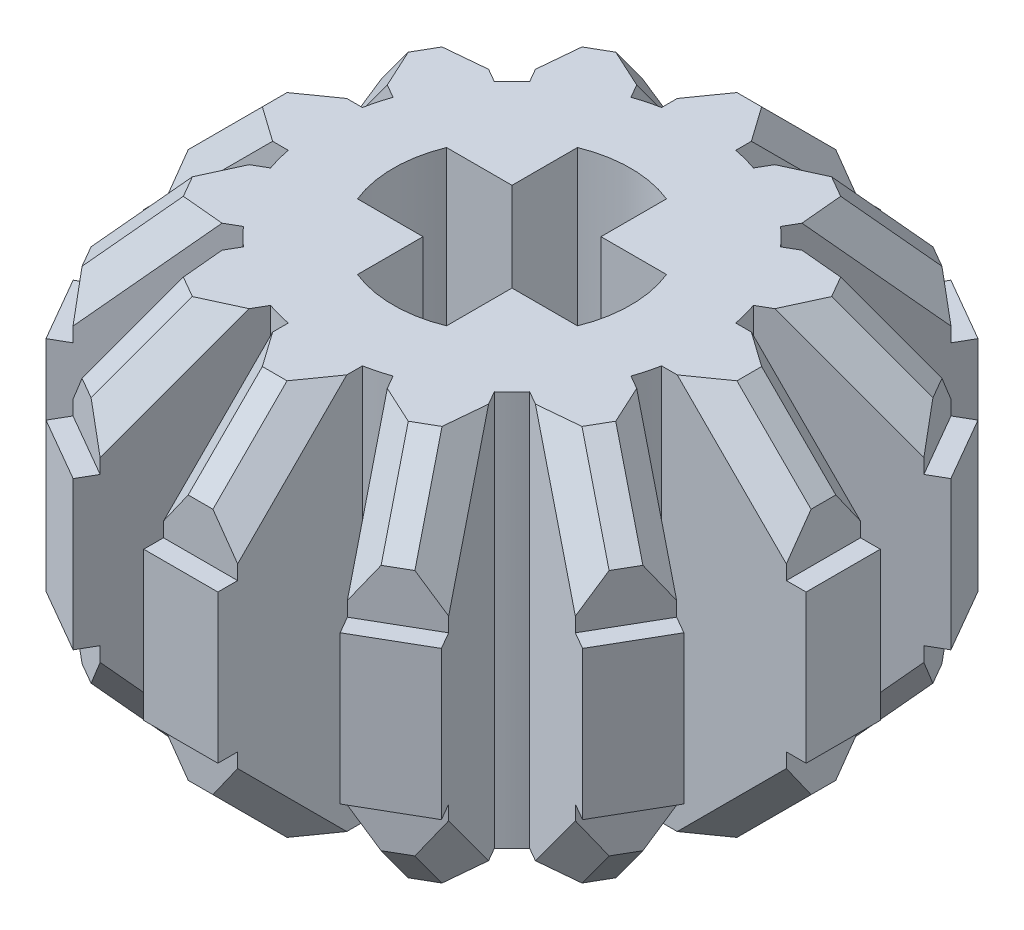
from build123d import *

# Parameters (mm, degrees)
SKETCH1_R                    = 3.85
GEAR_BODY_DEPTH              = 4
TOOTH_MIDDLE_DEPTH           = 1.5
TOOTH_OUTER_DEPTH            = 4
CHAMFER1_SIZE                = 1.5
CHAMFER2_SIZE                = 0.5
CIRPATTERN1_COUNT            = 12
CHAMFER1_OF_CIRPATTERN1_SIZE = 1.5
CHAMFER2_OF_CIRPATTERN1_SIZE = 0.5
AXLE_CUT_DEPTH               = 11.284940447
AXLE_CUT_DEPTH_BACK          = 11.284940447
SKETCH4_W                    = 1.8
SKETCH4_H                    = 1.8


with BuildPart() as part:
    # Sketch1 → Gear Body (new, symmetric)
    with BuildSketch(Plane(origin=(0, 0, 0), x_dir=(1, 0, 0), z_dir=(0, 1, 0))):
        with Locations(Location((0, 0, 0), (0, 0, 270))):
            Circle(SKETCH1_R)
    extrude(amount=GEAR_BODY_DEPTH, both=True)

    # Sketch2 → Tooth Middle (add, symmetric)
    with BuildSketch(Plane(origin=(0, 0, 0), x_dir=(1, 0, 0), z_dir=(0, 1, 0))):
        with BuildLine():
            ThreePointArc((-0.75, 3.776241518), (0, 3.85), (0.75, 3.776241518))
            Line((0.75, 3.776241518), (0.75, 6.7))
            Line((0.75, 6.7), (-0.75, 6.7))
            Line((-0.75, 6.7), (-0.75, 3.776241518))
        make_face()
    tooth_middle = extrude(amount=TOOTH_MIDDLE_DEPTH, both=True)

    # Sketch3 → Tooth Outer (add, symmetric)
    with BuildSketch(Plane(origin=(0, 0, 0), x_dir=(1, 0, 0), z_dir=(0, 1, 0))):
        with BuildLine():
            ThreePointArc((-0.75, 3.776241518), (0, 3.85), (0.75, 3.776241518))
            Line((0.75, 3.776241518), (0.75, 6.3))
            Line((0.75, 6.3), (-0.75, 6.3))
            Line((-0.75, 6.3), (-0.75, 3.776241518))
        make_face()
    tooth_outer = extrude(amount=TOOTH_OUTER_DEPTH, both=True)

    # Chamfer1
    chamfer1_edges = [part.edges().sort_by_distance(p)[0] for p in [
        (0, -4, -6.3),
        (0, 4, -6.3),
    ]]
    chamfer(chamfer1_edges, length=CHAMFER1_SIZE)

    # Chamfer2
    chamfer2_edges = [part.edges().sort_by_distance(p)[0] for p in [
        (-0.75, 3.25, -5.55),
        (-0.75, -3.25, -5.55),
        (0.75, 3.25, -5.55),
        (0.75, -3.25, -5.55),
    ]]
    chamfer(chamfer2_edges, length=CHAMFER2_SIZE)

    # CirPattern1: Tooth Middle, Tooth Outer ×12 about axis
    cirpattern1_axis = Axis((0, 0, 0), (0, 1, 0))
    add([tooth_middle.rotate(cirpattern1_axis, i * 360 / CIRPATTERN1_COUNT) for i in range(1, CIRPATTERN1_COUNT)])
    add([tooth_outer.rotate(cirpattern1_axis, i * 360 / CIRPATTERN1_COUNT) for i in range(1, CIRPATTERN1_COUNT)])

    # Chamfer1 of CirPattern1
    chamfer1_of_cirpattern1_edges = [part.edges().sort_by_distance(p)[0] for p in [
        (-3.15, -4, -5.455960044),
        (-3.15, 4, -5.455960044),
        (-5.455960044, -4, -3.15),
        (-5.455960044, 4, -3.15),
        (-6.3, -4, 0),
        (-6.3, 4, 0),
        (-5.455960044, -4, 3.15),
        (-5.455960044, 4, 3.15),
        (-3.15, -4, 5.455960044),
        (-3.15, 4, 5.455960044),
        (0, -4, 6.3),
        (0, 4, 6.3),
        (3.15, -4, 5.455960044),
        (3.15, 4, 5.455960044),
        (5.455960044, -4, 3.15),
        (5.455960044, 4, 3.15),
        (6.3, -4, 0),
        (6.3, 4, 0),
        (5.455960044, -4, -3.15),
        (5.455960044, 4, -3.15),
        (3.15, -4, -5.455960044),
        (3.15, 4, -5.455960044),
    ]]
    chamfer(chamfer1_of_cirpattern1_edges, length=CHAMFER1_OF_CIRPATTERN1_SIZE)

    # Chamfer2 of CirPattern1
    chamfer2_of_cirpattern1_edges = [part.edges().sort_by_distance(p)[0] for p in [
        (-3.424519053, 3.25, -4.431440991),
        (-3.424519053, -3.25, -4.431440991),
        (-2.125480947, 3.25, -5.181440991),
        (-2.125480947, -3.25, -5.181440991),
        (-5.181440991, 3.25, -2.125480947),
        (-5.181440991, -3.25, -2.125480947),
        (-4.431440991, 3.25, -3.424519053),
        (-4.431440991, -3.25, -3.424519053),
        (-5.55, 3.25, 0.75),
        (-5.55, -3.25, 0.75),
        (-5.55, 3.25, -0.75),
        (-5.55, -3.25, -0.75),
        (-4.431440991, 3.25, 3.424519053),
        (-4.431440991, -3.25, 3.424519053),
        (-5.181440991, 3.25, 2.125480947),
        (-5.181440991, -3.25, 2.125480947),
        (-2.125480947, 3.25, 5.181440991),
        (-2.125480947, -3.25, 5.181440991),
        (-3.424519053, 3.25, 4.431440991),
        (-3.424519053, -3.25, 4.431440991),
        (0.75, 3.25, 5.55),
        (0.75, -3.25, 5.55),
        (-0.75, 3.25, 5.55),
        (-0.75, -3.25, 5.55),
        (3.424519053, 3.25, 4.431440991),
        (3.424519053, -3.25, 4.431440991),
        (2.125480947, 3.25, 5.181440991),
        (2.125480947, -3.25, 5.181440991),
        (5.181440991, 3.25, 2.125480947),
        (5.181440991, -3.25, 2.125480947),
        (4.431440991, 3.25, 3.424519053),
        (4.431440991, -3.25, 3.424519053),
        (5.55, 3.25, -0.75),
        (5.55, -3.25, -0.75),
        (5.55, 3.25, 0.75),
        (5.55, -3.25, 0.75),
        (4.431440991, 3.25, -3.424519053),
        (4.431440991, -3.25, -3.424519053),
        (5.181440991, 3.25, -2.125480947),
        (5.181440991, -3.25, -2.125480947),
        (2.125480947, 3.25, -5.181440991),
        (2.125480947, -3.25, -5.181440991),
        (3.424519053, 3.25, -4.431440991),
        (3.424519053, -3.25, -4.431440991),
    ]]
    chamfer(chamfer2_of_cirpattern1_edges, length=CHAMFER2_OF_CIRPATTERN1_SIZE)

    # Sketch4 → Axle Cut (cut, two sides: drawn at the far end of the back side and taken through both)
    with BuildSketch(Plane(origin=(0, 0, 0), x_dir=(1, 0, 0), z_dir=(0, 1, 0)).offset(-AXLE_CUT_DEPTH_BACK)):
        with BuildLine():
            Line((-0.9, 0.9), (0.9, 0.9))
            Line((0.9, 0.9), (0.9, 2.224859546))
            ThreePointArc((0.9, 2.224859546), (0.45844143, 2.355808026), (0, 2.4))
            ThreePointArc((0, 2.4), (-0.45844143, 2.355808026), (-0.9, 2.224859546))
            Line((-0.9, 2.224859546), (-0.9, 0.9))
        make_face()
        with BuildLine():
            Line((-2.224859546, -0.9), (-0.9, -0.9))
            Line((-0.9, -0.9), (-0.9, 0.9))
            Line((-0.9, 0.9), (-2.224859546, 0.9))
            ThreePointArc((-2.224859546, 0.9), (-2.355808026, 0.45844143), (-2.4, 0))
            ThreePointArc((-2.4, 0), (-2.355808026, -0.45844143), (-2.224859546, -0.9))
        make_face()
        with BuildLine():
            Line((0.9, -2.224859546), (0.9, -0.9))
            Line((0.9, -0.9), (-0.9, -0.9))
            Line((-0.9, -0.9), (-0.9, -2.224859546))
            ThreePointArc((-0.9, -2.224859546), (-0.45844143, -2.355808026), (0, -2.4))
            ThreePointArc((0, -2.4), (0.45844143, -2.355808026), (0.9, -2.224859546))
        make_face()
        with BuildLine():
            Line((0.9, -0.9), (2.224859546, -0.9))
            ThreePointArc((2.224859546, -0.9), (2.355808026, -0.45844143), (2.4, 0))
            ThreePointArc((2.4, 0), (2.355808026, 0.45844143), (2.224859546, 0.9))
            Line((2.224859546, 0.9), (0.9, 0.9))
            Line((0.9, 0.9), (0.9, -0.9))
        make_face()
        Rectangle(SKETCH4_W, SKETCH4_H)
    extrude(amount=AXLE_CUT_DEPTH + AXLE_CUT_DEPTH_BACK, mode=Mode.SUBTRACT)


solid = part.part
